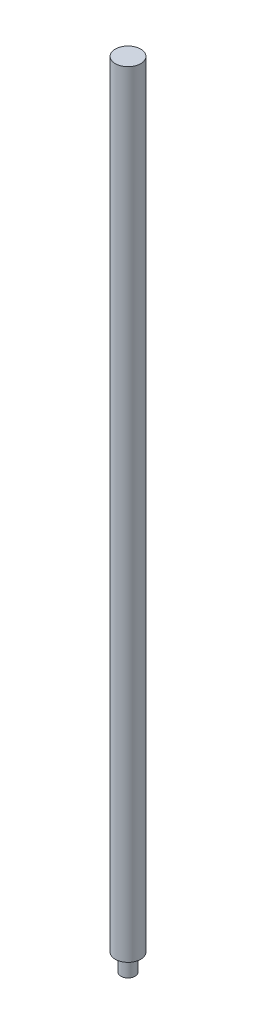
from build123d import *

# Parameters (mm, degrees)
SKETCH_1_R          = 8
EXTRUDE_1_DEPTH     = 500
SKETCH_2_OUTSIDE_W  = 118.102
SKETCH_2_OUTSIDE_H  = 118.102
SKETCH_2_OUTSIDE_R  = 4.5
CUT_EXTRUDE_1_DEPTH = 11


with BuildPart() as part:
    # 草图1 → 凸台-拉伸1 (new body)
    with BuildSketch(Plane(origin=(0, 0, 0), x_dir=(1, 0, 0), z_dir=(0, 1, 0))):
        with Locations(Location((0, 0, 0), (0, 0, 270))):
            Circle(SKETCH_1_R)
    extrude(amount=EXTRUDE_1_DEPTH)

    # 草图2 outside → 切除-拉伸1 (cut)
    with BuildSketch(Plane.XZ):
        Rectangle(SKETCH_2_OUTSIDE_W, SKETCH_2_OUTSIDE_H)
        with Locations(Location((0, 0, 0), (0, 0, 270))):
            Circle(SKETCH_2_OUTSIDE_R, mode=Mode.SUBTRACT)
    extrude(amount=-CUT_EXTRUDE_1_DEPTH, mode=Mode.SUBTRACT)


solid = part.part
